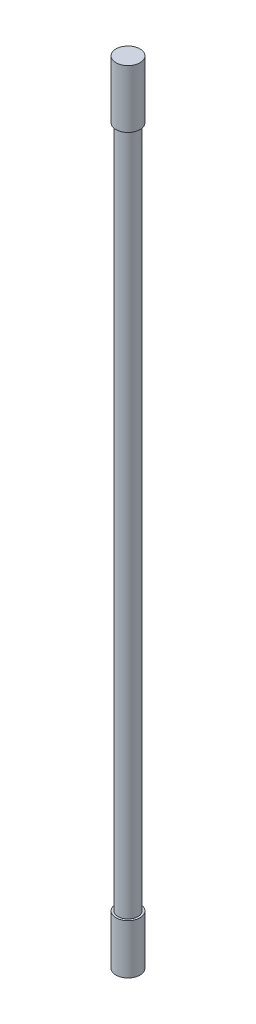
from build123d import *

# Parameters (mm, degrees)
SKETCH1_R           = 2.9
BOSS_EXTRUDE1_DEPTH = 12
SKETCH2_R           = 2.4
BOSS_EXTRUDE2_DEPTH = 165
SKETCH3_R           = 2.9
BOSS_EXTRUDE3_DEPTH = 14


with BuildPart() as part:
    # Sketch1 → Boss-Extrude1 (new body)
    with BuildSketch(Plane(origin=(0, 0, 0), x_dir=(1, 0, 0), z_dir=(0, 1, 0))):
        with Locations(Location((0, 0, 0), (0, 0, 270))):
            Circle(SKETCH1_R)
    extrude(amount=BOSS_EXTRUDE1_DEPTH)

    # Sketch2 → Boss-Extrude2 (add)
    with BuildSketch(Plane(origin=(0, 12, 0), x_dir=(1, 0, 0), z_dir=(0, 1, 0))):
        with Locations(Location((0, 0, 0), (0, 0, 270))):
            Circle(SKETCH2_R)
    extrude(amount=BOSS_EXTRUDE2_DEPTH)

    # Sketch3 → Boss-Extrude3 (add)
    with BuildSketch(Plane(origin=(0, 177, 0), x_dir=(1, 0, 0), z_dir=(0, 1, 0))):
        with Locations(Location((0, 0, 0), (0, 0, 270))):
            Circle(SKETCH3_R)
    extrude(amount=BOSS_EXTRUDE3_DEPTH)


solid = part.part
